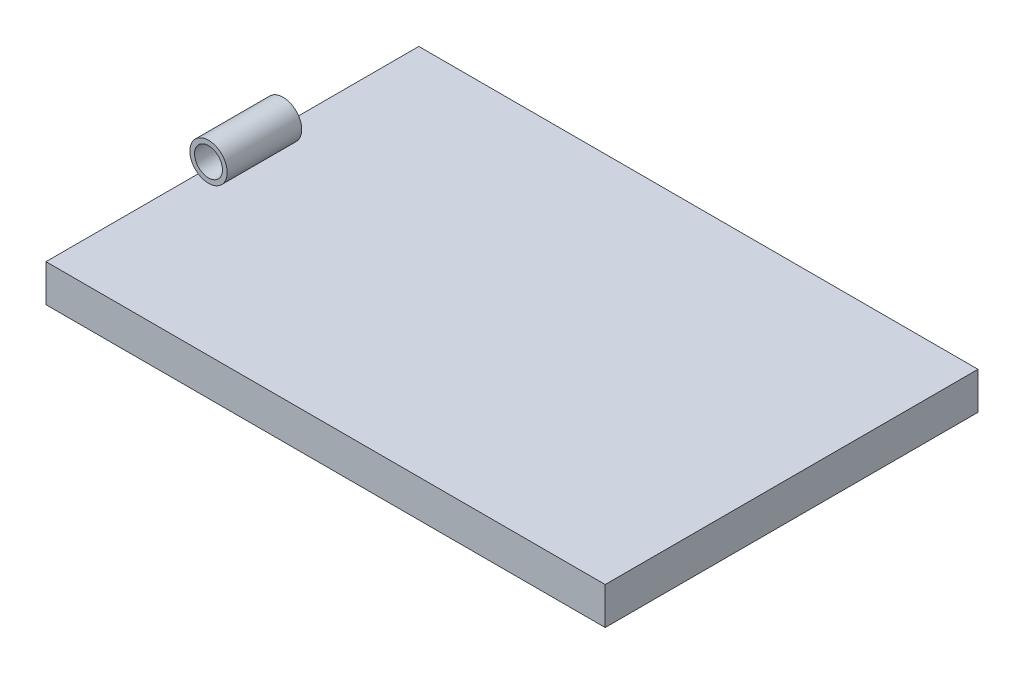
from build123d import *

# Parameters (mm, degrees)
SKETCH1_W                = 76.2
SKETCH1_H                = 50.8
BOSS_EXTRUDE1_DEPTH      = 5.08
BOSS_EXTRUDE2_DEPTH      = 5.08
BOSS_EXTRUDE2_DEPTH_BACK = 5.08
SKETCH2_R                = 2.54
SKETCH2_R_2              = 1.905


with BuildPart() as part:
    # Sketch1 → Boss-Extrude1 (new body)
    with BuildSketch(Plane(origin=(0, 0, 0), x_dir=(1, 0, 0), z_dir=(0, 1, 0))):
        with Locations((38.1, 25.4)):
            Rectangle(SKETCH1_W, SKETCH1_H)
    extrude(amount=BOSS_EXTRUDE1_DEPTH)


with BuildPart() as body_2:
    # Sketch2 → Boss-Extrude2 (new, two sides: drawn at the far end of the back side and taken through both)
    with BuildSketch(Plane.XY.offset(-25.4).offset(-BOSS_EXTRUDE2_DEPTH_BACK)):
        with Locations((1.825387068, 7.62)):
            Circle(SKETCH2_R)
        with Locations((1.825387068, 7.62)):
            Circle(SKETCH2_R_2, mode=Mode.SUBTRACT)
    extrude(amount=BOSS_EXTRUDE2_DEPTH + BOSS_EXTRUDE2_DEPTH_BACK)


solid = Compound([part.part, body_2.part])
